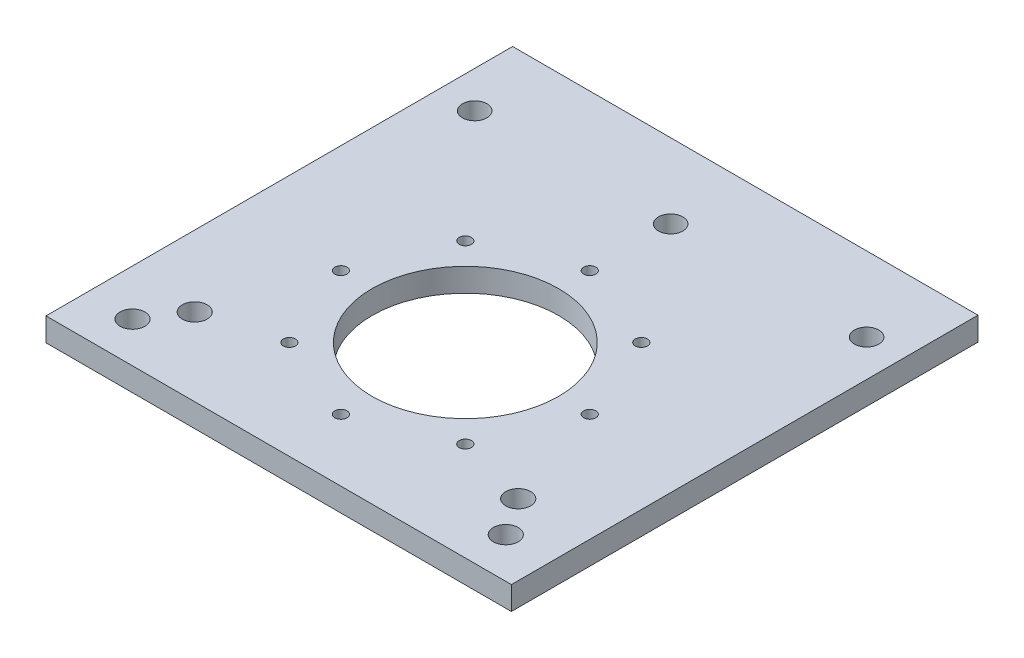
from build123d import *

# Parameters (mm, degrees)
SKETCH2_W                 = 95
SKETCH2_H                 = 95.25
BOSS_EXTRUDE3_DEPTH       = 4.7625
SKETCH3_R                 = 19.05
CUT_EXTRUDE1_DEPTH        = 77.928778953
M6X1_0_TAPPED_HOLE1_D     = 5
M6X1_0_TAPPED_HOLE1_DEPTH = 4.7625
M6X1_0_TAPPED_HOLE1_TIP   = 1.502151548
SKETCH7_R                 = 2.54
CUT_EXTRUDE2_DEPTH        = 7.62
SKETCH12_R                = 1.2446
CUT_EXTRUDE3_DEPTH        = 77.928778953


with BuildPart() as part:
    # Sketch2 → Boss-Extrude3 (new body)
    with BuildSketch(Plane(origin=(0, 0, 0), x_dir=(1, 0, 0), z_dir=(0, 1, 0))):
        with Locations((0, -12.7)):
            Rectangle(SKETCH2_W, SKETCH2_H)
    extrude(amount=BOSS_EXTRUDE3_DEPTH)

    # Sketch3 → Cut-Extrude1 (cut, through all)
    with BuildSketch(Plane(origin=(0, 4.7625, 0), x_dir=(1, 0, 0), z_dir=(0, 1, 0))):
        with Locations(Location((0, -22.225, 0), (0, 0, 270))):
            Circle(SKETCH3_R)
    extrude(amount=-CUT_EXTRUDE1_DEPTH, mode=Mode.SUBTRACT)

    # M6x1.0 Tapped Hole1
    with Locations(Plane(origin=(0, 4.7625, 0), x_dir=(1, 0, 0), z_dir=(0, 1, 0))):
        with Locations((-40, 19.685), (40, 19.685), (0, 19.685)):
            Hole(M6X1_0_TAPPED_HOLE1_D / 2, depth=M6X1_0_TAPPED_HOLE1_DEPTH)
            with Locations((0, 0, -(M6X1_0_TAPPED_HOLE1_DEPTH + M6X1_0_TAPPED_HOLE1_TIP / 2))):  # 118° drill point
                Cone(0, M6X1_0_TAPPED_HOLE1_D / 2, M6X1_0_TAPPED_HOLE1_TIP, mode=Mode.SUBTRACT)

    # Sketch7 → Cut-Extrude2 (cut)
    with BuildSketch(Plane(origin=(0, 4.7625, 0), x_dir=(1, 0, 0), z_dir=(0, 1, 0))):
        with Locations(Location((-33.02, -44.45, 0), (0, 0, 270))):
            Circle(SKETCH7_R)
        with Locations(Location((33.02, -44.45, 0), (0, 0, 270))):
            Circle(SKETCH7_R)
        with Locations(Location((-38.1, -52.07, 0), (0, 0, 270))):
            Circle(SKETCH7_R)
        with Locations(Location((38.1, -52.07, 0), (0, 0, 270))):
            Circle(SKETCH7_R)
    extrude(amount=-CUT_EXTRUDE2_DEPTH, mode=Mode.SUBTRACT)

    # Sketch12 → Cut-Extrude3 (cut, through all)
    with BuildSketch(Plane(origin=(0, 4.7625, 0), x_dir=(1, 0, 0), z_dir=(0, 1, 0))):
        with Locations(Location((0, 3.175, 0), (0, 0, 270))):
            Circle(SKETCH12_R)
        with Locations(Location((17.960512242, -4.264487758, 0), (0, 0, 270))):
            Circle(SKETCH12_R)
        with Locations(Location((25.4, -22.225, 0), (0, 0, 270))):
            Circle(SKETCH12_R)
        with Locations(Location((17.960512242, -40.185512242, 0), (0, 0, 270))):
            Circle(SKETCH12_R)
        with Locations(Location((0, -47.625, 0), (0, 0, 270))):
            Circle(SKETCH12_R)
        with Locations(Location((-17.960512242, -40.185512242, 0), (0, 0, 270))):
            Circle(SKETCH12_R)
        with Locations(Location((-25.4, -22.225, 0), (0, 0, 270))):
            Circle(SKETCH12_R)
        with Locations(Location((-17.960512242, -4.264487758, 0), (0, 0, 270))):
            Circle(SKETCH12_R)
    extrude(amount=-CUT_EXTRUDE3_DEPTH, mode=Mode.SUBTRACT)


solid = part.part
